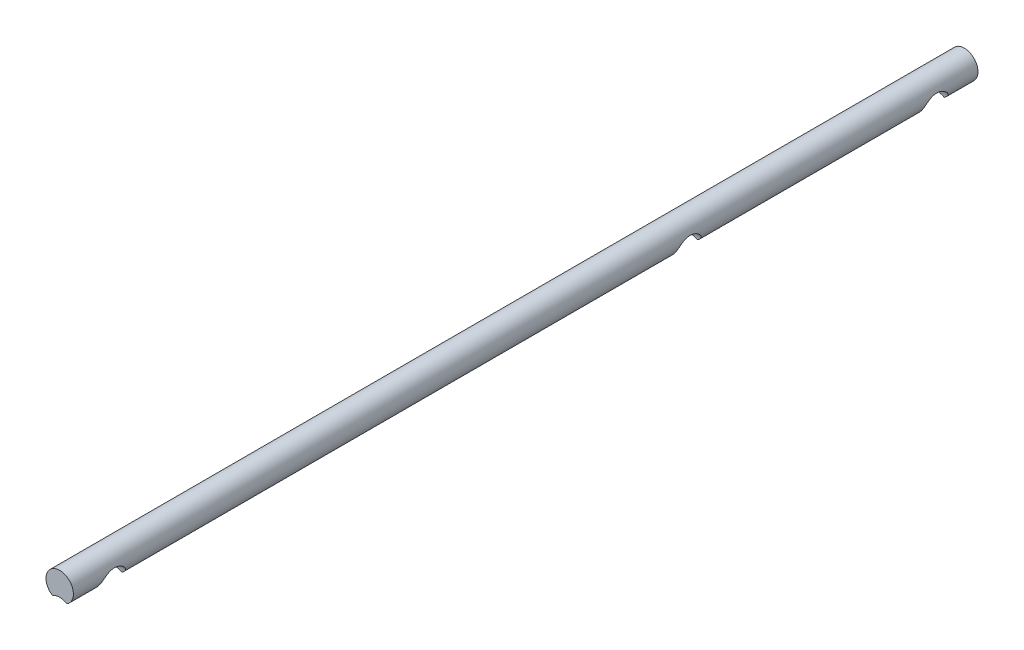
from build123d import *

# Parameters (mm, degrees)
EXTRUDE_1_DEPTH     = 3300
SKETCH_2_R          = 100
CUT_EXTRUDE_1_DEPTH = 3000


with BuildPart() as part:
    # Эскиз1 → Бобышка-Вытянуть1 (new, symmetric)
    with BuildSketch(Plane.XY):
        with BuildLine():
            ThreePointArc((100, 0), (70.710678119, 70.710678119), (0, 100))
            Line((0, 100), (0, -70))
            ThreePointArc((0, -70), (27.658633372, -73.708341903), (53.363596856, -84.571428571))
            ThreePointArc((53.363596856, -84.571428571), (87.568143995, -48.288923753), (100, 0))
        make_face()
        with BuildLine():
            Line((0, -70), (0, 100))
            ThreePointArc((0, 100), (-96.065453877, 27.774602993), (-53.363596856, -84.571428571))
            ThreePointArc((-53.363596856, -84.571428571), (-27.658633372, -73.708341903), (0, -70))
        make_face()
        with BuildLine():
            ThreePointArc((100, 0), (70.710678119, 70.710678119), (0, 100))
            Line((0, 100), (0, -70))
            ThreePointArc((0, -70), (27.658633372, -73.708341903), (53.363596856, -84.571428571))
            ThreePointArc((53.363596856, -84.571428571), (87.568143995, -48.288923753), (100, 0))
        make_face()
        with BuildLine():
            Line((0, -70), (0, 100))
            ThreePointArc((0, 100), (-96.065453877, 27.774602993), (-53.363596856, -84.571428571))
            ThreePointArc((-53.363596856, -84.571428571), (-27.658633372, -73.708341903), (0, -70))
        make_face()
    extrude(amount=EXTRUDE_1_DEPTH, both=True)

    # Эскиз2 → Вырез-Вытянуть1 (cut, symmetric)
    with BuildSketch(Plane(origin=(0, 0, 0), x_dir=(0, 0, -1), z_dir=(1, 0, 0))):
        with Locations((-3000, -84.571428571)):
            Circle(SKETCH_2_R)
        with Locations((3000, -84.571428571)):
            Circle(SKETCH_2_R)
        with Locations((1200, -84.571428571)):
            Circle(SKETCH_2_R)
    extrude(amount=CUT_EXTRUDE_1_DEPTH, both=True, mode=Mode.SUBTRACT)


solid = part.part
